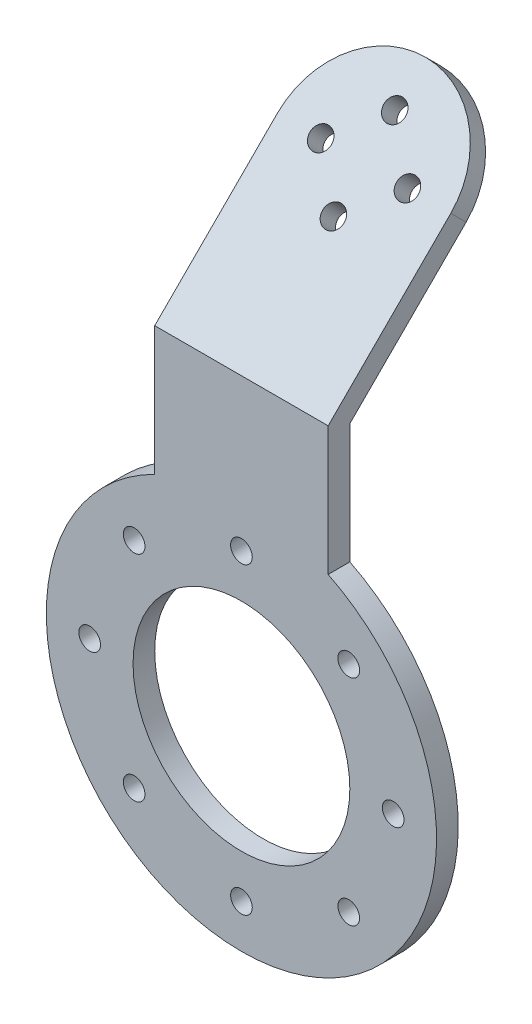
from build123d import *

# Parameters (mm, degrees)
SKETCH1_R         = 15.875
EXTRUDE1_DEPTH    = 3.175
EXTRUDE2_DEPTH    = 3.175
SKETCH3_R         = 1.5875
EXTRUDE3_DEPTH    = 83.249530363
CIRPATTERN1_COUNT = 8
SKETCH4_R         = 1.5875
EXTRUDE4_DEPTH    = 78.738955692
CIRPATTERN2_COUNT = 4


with BuildPart() as part:
    # Sketch1 → Extrude1 (new body)
    with BuildSketch(Plane.XY):
        with BuildLine():
            Line((-12.7, 25.597668351), (-12.7, 44.45))
            Line((-12.7, 44.45), (12.7, 44.45))
            Line((12.7, 44.45), (12.7, 25.597668351))
            ThreePointArc((12.7, 25.597668351), (0, -28.575), (-12.7, 25.597668351))
        make_face()
        Circle(SKETCH1_R, mode=Mode.SUBTRACT)
    extrude(amount=EXTRUDE1_DEPTH)

    # Sketch2 → Extrude2 (add)
    with BuildSketch(Plane(origin=(0, 23.8125, 23.8125), x_dir=(-1, 0, 0), z_dir=(0, 0.7071067811865488, 0.7071067811865462))):
        with BuildLine():
            Line((12.7, -29.185832393), (12.7, -54.585832393))
            ThreePointArc((12.7, -54.585832393), (0, -67.285832393), (-12.7, -54.585832393))
            Line((-12.7, -54.585832393), (-12.7, -29.185832393))
            Line((-12.7, -29.185832393), (12.7, -29.185832393))
        make_face()
    extrude(amount=-EXTRUDE2_DEPTH)

    # Sketch3 → Extrude3 (cut, through all)
    with BuildSketch(Plane.XY.offset(3.175)):
        with Locations((0, 22.225)):
            Circle(SKETCH3_R)
    extrude3 = extrude(amount=-EXTRUDE3_DEPTH, mode=Mode.SUBTRACT)

    # CirPattern1: Extrude3 ×8 about axis
    cirpattern1_axis = Axis((0, 0, 0), (0, 0, 1))
    for i in range(1, CIRPATTERN1_COUNT):
        add(extrude3.rotate(cirpattern1_axis, i * 360 / CIRPATTERN1_COUNT), mode=Mode.SUBTRACT)

    # Sketch4 → Extrude4 (cut, through all)
    with BuildSketch(Plane(origin=(0, 23.8125, 23.8125), x_dir=(1, 0, 0), z_dir=(0, 0.7071067811865488, 0.7071067811865462))):
        with Locations(Location((0, 60.935832393, 0), (0, 0, 270))):
            Circle(SKETCH4_R)
    extrude4 = extrude(amount=-EXTRUDE4_DEPTH, mode=Mode.SUBTRACT)

    # CirPattern2: Extrude4 ×4 about axis
    cirpattern2_axis = Axis((0, 38.598012242, -38.598012242), (0, 0.7071067811865488, 0.7071067811865462))
    for i in range(1, CIRPATTERN2_COUNT):
        add(extrude4.rotate(cirpattern2_axis, i * 360 / CIRPATTERN2_COUNT), mode=Mode.SUBTRACT)


solid = part.part
